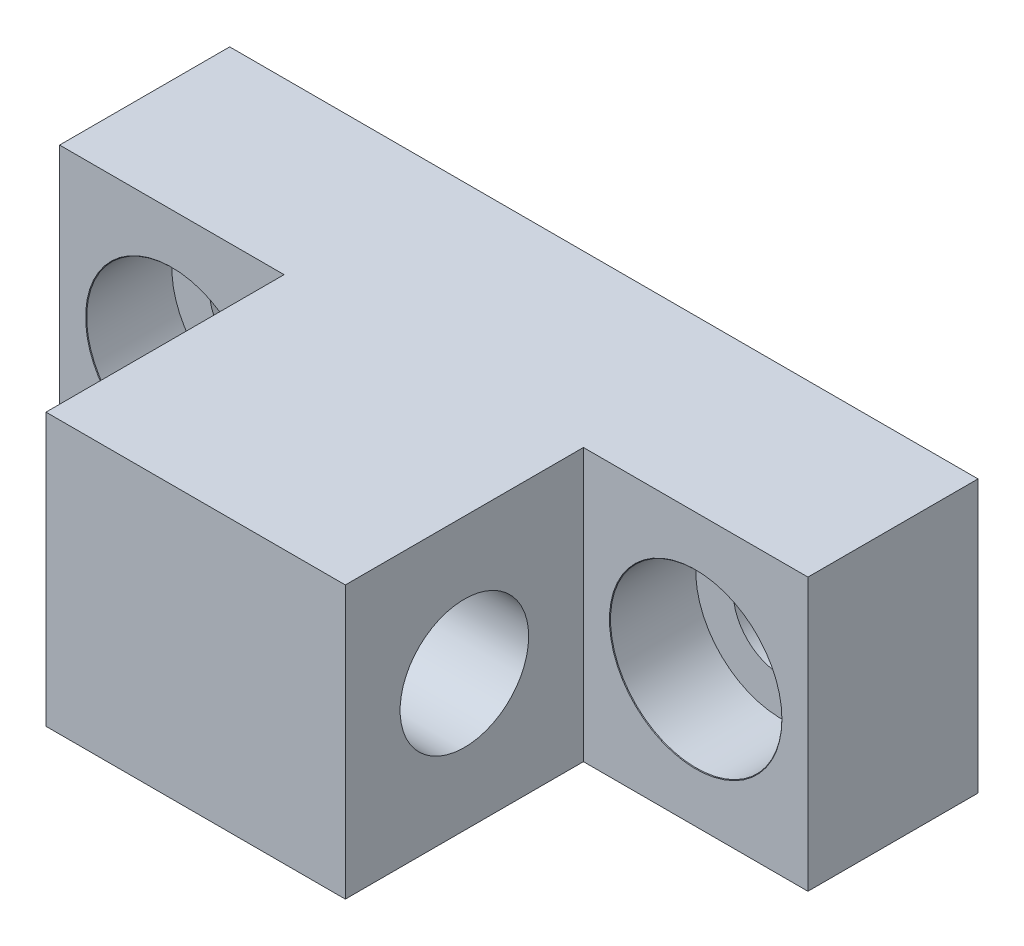
from build123d import *

# Parameters (mm, degrees)
SKETCH1_W                     = 10.4775
SKETCH1_H                     = 12.7
SKETCH1_R                     = 2
SKETCH1_W_2                   = 13.97
BOSS_EXTRUDE1_DEPTH           = 7.9375
SKETCH2_W                     = 13.97
SKETCH2_H                     = 12.7
BOSS_EXTRUDE2_DEPTH           = 11.1125
CUT_EXTRUDE1_DEPTH            = 11.43
SKETCH4_R                     = 1.143
CUT_EXTRUDE2_DEPTH            = 32.637086722
CBORE_FOR_M4_SHCS1_AT_2_COUNT = 2
CBORE_FOR_M4_SHCS1_AT_2_PITCH = 24.4475
SKETCH8_R                     = 3
SKETCH8_R_2                   = 1.143
CUT_EXTRUDE3_DEPTH            = 32.637086722


with BuildPart() as part:
    # Sketch1 → Boss-Extrude1 (new body)
    # profile 1 of 5: a face of its own
    with BuildSketch(Plane.XY):
        with Locations((12.22375, 0)):
            Rectangle(SKETCH1_W, SKETCH1_H)
        with Locations((12.22375, 0)):
            Circle(SKETCH1_R, mode=Mode.SUBTRACT)
    # profile 2 of 5: a face of its own
    with BuildSketch(Plane.XY):
        Rectangle(SKETCH1_W_2, SKETCH1_H)
    # profile 3 of 5: a face of its own
    with BuildSketch(Plane.XY):
        with Locations((-12.22375, 0)):
            Rectangle(SKETCH1_W, SKETCH1_H)
        with Locations((-12.22375, 0)):
            Circle(SKETCH1_R, mode=Mode.SUBTRACT)
    # profile 4 of 5: a face of its own
    with BuildSketch(Plane.XY):
        with Locations((12.22375, 0)):
            Circle(SKETCH1_R)
    # profile 5 of 5: a face of its own
    with BuildSketch(Plane.XY):
        with Locations((-12.22375, 0)):
            Circle(SKETCH1_R)
    extrude(amount=BOSS_EXTRUDE1_DEPTH)

    # Sketch2 → Boss-Extrude2 (add)
    with BuildSketch(Plane.XY.offset(7.9375)):
        Rectangle(SKETCH2_W, SKETCH2_H)
    extrude(amount=BOSS_EXTRUDE2_DEPTH)

    # Sketch3 → Cut-Extrude1 (cut)
    with BuildSketch(Plane(origin=(6.985, 0, 0), x_dir=(0, 0, -1), z_dir=(1, 0, 0))):
        with BuildLine():
            ThreePointArc((-13.49375, 3), (-16.49375, 0), (-13.49375, -3))
            Line((-13.49375, -3), (-13.49375, -1.143))
            ThreePointArc((-13.49375, -1.143), (-14.63675, 0), (-13.49375, 1.143))
            Line((-13.49375, 1.143), (-13.49375, 3))
        make_face()
        with BuildLine():
            Line((-13.49375, -1.143), (-13.49375, -3))
            ThreePointArc((-13.49375, -3), (-11.372429656, -2.121320344), (-10.49375, 0))
            ThreePointArc((-10.49375, 0), (-11.372429656, 2.121320344), (-13.49375, 3))
            Line((-13.49375, 3), (-13.49375, 1.143))
            ThreePointArc((-13.49375, 1.143), (-12.685526949, 0.808223051), (-12.35075, 0))
            ThreePointArc((-12.35075, 0), (-12.685526949, -0.808223051), (-13.49375, -1.143))
        make_face()
        with BuildLine():
            ThreePointArc((-13.49375, 1.143), (-14.63675, 0), (-13.49375, -1.143))
            Line((-13.49375, -1.143), (-13.49375, 1.143))
        make_face()
        with BuildLine():
            Line((-13.49375, 1.143), (-13.49375, -1.143))
            ThreePointArc((-13.49375, -1.143), (-12.685526949, -0.808223051), (-12.35075, 0))
            ThreePointArc((-12.35075, 0), (-12.685526949, 0.808223051), (-13.49375, 1.143))
        make_face()
    extrude(amount=-CUT_EXTRUDE1_DEPTH, mode=Mode.SUBTRACT)

    # Sketch4 → Cut-Extrude2 (cut, through all)
    with BuildSketch(Plane(origin=(6.985, 0, 0), x_dir=(0, 0, -1), z_dir=(1, 0, 0))):
        with Locations((-13.49375, 0)):
            Circle(SKETCH4_R)
    extrude(amount=-CUT_EXTRUDE2_DEPTH, mode=Mode.SUBTRACT)

    # Sketch6 → CBORE for M4 SHCS1 (revolve, cut)
    with BuildSketch(Plane(origin=(12.22375, 0, 7.9375), x_dir=(0, -1, 0), z_dir=(1, 0, 0))):
        Polygon((0, 0), (0, 7.9375), (2.25, 7.9375), (2.25, 4), (4, 4), (4, 0.025), (4.025, 0), align=None)
    cbore_for_m4_shcs1 = revolve(axis=Axis((12.22375, 0, 14.2875), (0, 0, -1)), mode=Mode.SUBTRACT)

    # CBORE for M4 SHCS1 at 2: CBORE for M4 SHCS1 ×2
    with Locations(*[(-i * CBORE_FOR_M4_SHCS1_AT_2_PITCH, 0, 0) for i in range(1, CBORE_FOR_M4_SHCS1_AT_2_COUNT)]):
        add(cbore_for_m4_shcs1, mode=Mode.SUBTRACT)

    # Sketch8 → Cut-Extrude3 (cut, through all)
    # profile 1 of 2: a face of its own
    with BuildSketch(Plane(origin=(6.985, 0, 0), x_dir=(0, 0, -1), z_dir=(1, 0, 0))):
        with Locations((-13.49375, 0)):
            Circle(SKETCH8_R)
        with Locations((-13.49375, 0)):
            Circle(SKETCH8_R_2, mode=Mode.SUBTRACT)
    # profile 2 of 2: a face of its own
    with BuildSketch(Plane(origin=(6.985, 0, 0), x_dir=(0, 0, -1), z_dir=(1, 0, 0))):
        with Locations((-13.49375, 0)):
            Circle(SKETCH8_R_2)
    extrude(amount=-CUT_EXTRUDE3_DEPTH, mode=Mode.SUBTRACT)


solid = part.part
